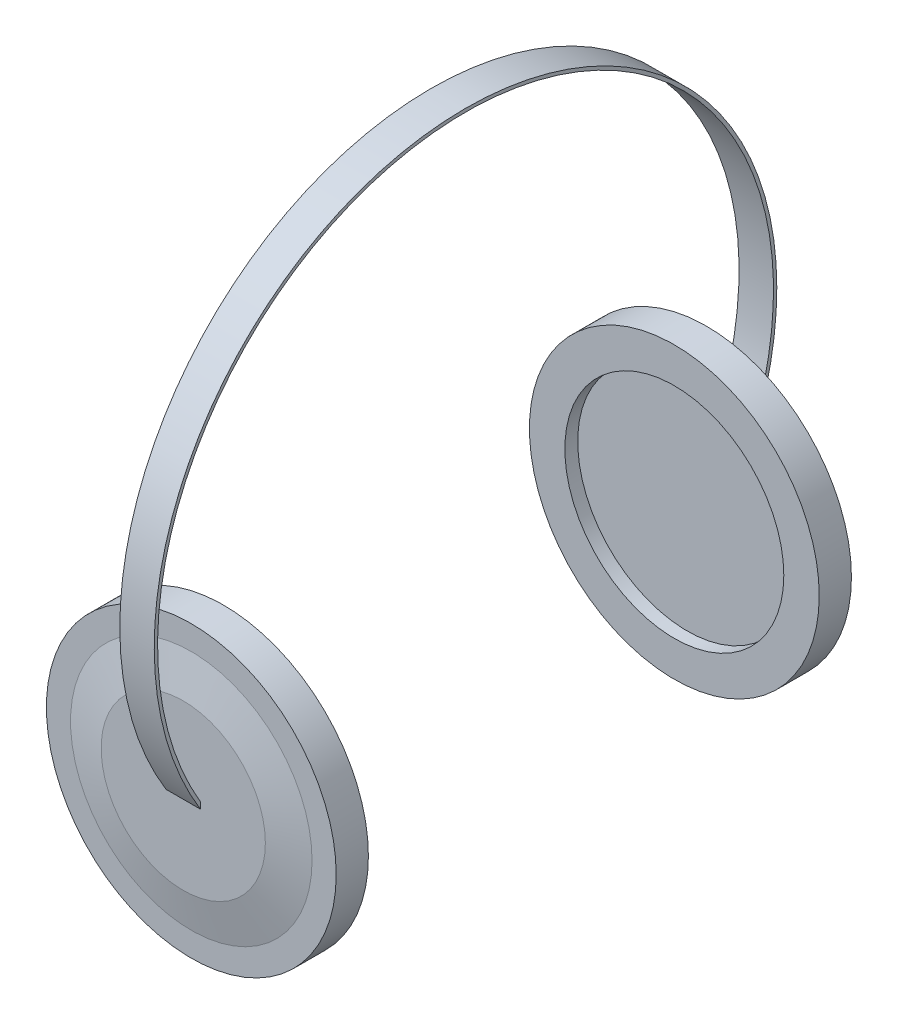
from build123d import *

# Parameters (mm, degrees)
SKETCH_1_R          = 90
EXTRUDE_1_DEPTH     = 20
SKETCH_2_R          = 90
EXTRUDE_2_DEPTH     = 20
SKETCH_3_R          = 68
CUT_EXTRUDE_1_DEPTH = 8
SKETCH_4_R          = 68
CUT_EXTRUDE_2_DEPTH = 8
SKETCH_5_R          = 75
SKETCH_7_R          = 51
SKETCH_8_R          = 75
SKETCH_9_R          = 51
SKETCH_11_W         = 21.388157758
SKETCH_11_H         = 3.979192142


with BuildPart() as part:
    # 草图1 → 凸台-拉伸1 (new body)
    with BuildSketch(Plane.XY):
        Circle(SKETCH_1_R)
    extrude(amount=EXTRUDE_1_DEPTH)

    # 草图4 → 切除-拉伸2 (cut)
    with BuildSketch(Plane.XY.offset(20)):
        with Locations(Location((0, 0, 0), (0, 0, 180))):
            Circle(SKETCH_4_R)
    extrude(amount=-CUT_EXTRUDE_2_DEPTH, mode=Mode.SUBTRACT)

    # 草图8 → 放样2 section 0
    with BuildSketch(Plane(origin=(0, 0, 0), x_dir=(-1, 0, 0), z_dir=(0, 0, -1))):
        Circle(SKETCH_8_R)
    # 草图9 → 放样2 section 1
    with BuildSketch(Plane(origin=(0, 0, -5), x_dir=(-1, 0, 0), z_dir=(0, 0, -1))):
        Circle(SKETCH_9_R)
    loft()



with BuildPart() as body_2:
    # 草图2 → 凸台-拉伸2 (new body)
    with BuildSketch(Plane.XY.offset(300)):
        Circle(SKETCH_2_R)
    extrude(amount=EXTRUDE_2_DEPTH)

    # 草图3 → 切除-拉伸1 (cut)
    with BuildSketch(Plane(origin=(0, 0, 300), x_dir=(-1, 0, 0), z_dir=(0, 0, -1))):
        Circle(SKETCH_3_R)
    extrude(amount=-CUT_EXTRUDE_1_DEPTH, mode=Mode.SUBTRACT)

    # 草图5 → 放样1 section 0
    with BuildSketch(Plane.XY.offset(320)):
        Circle(SKETCH_5_R)
    # 草图7 → 放样1 section 1
    with BuildSketch(Plane.XY.offset(325)):
        Circle(SKETCH_7_R)
    loft()


with BuildPart() as part_1:
    add(part.part)

    add(body_2.part)  # 扫描1 merges body 2
    # 扫描1: sweep along a path in 草图14
    with BuildLine(Plane(origin=(0, 0, 0), x_dir=(0, 0, -1), z_dir=(1, 0, 0))) as sweep_1_path:
        ThreePointArc((-5.541455061, -14.409759427), (-160.373186446, 291.522166595), (-315.20491783, -14.409759427))
    # 草图11 → 扫描1 (sweep)
    with BuildSketch(Plane.XY.offset(325)):
        Rectangle(SKETCH_11_W, SKETCH_11_H)
    sweep(path=sweep_1_path.line)


solid = part_1.part
